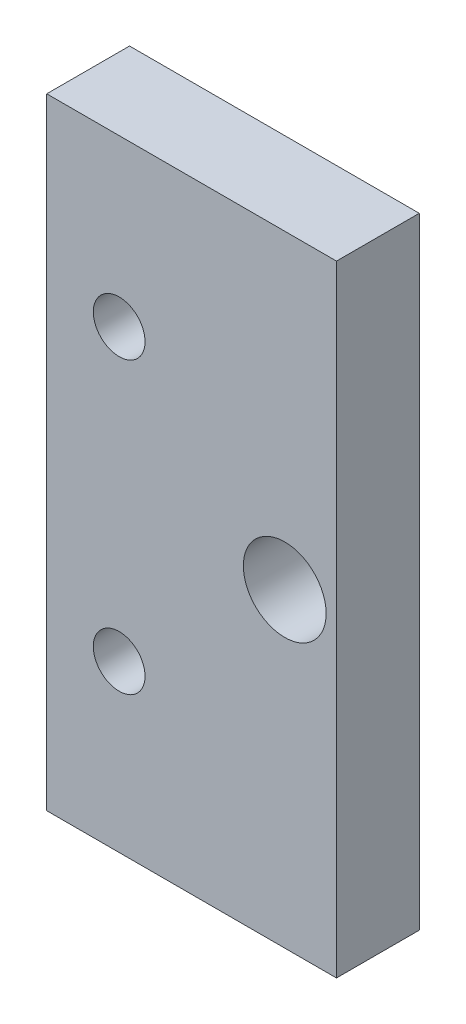
from build123d import *

# Parameters (mm, degrees)
SKETCH1_W      = 17.78
SKETCH1_H      = 38.1
SKETCH1_R      = 2.54
SKETCH1_R_2    = 1.5875
EXTRUDE1_DEPTH = 5.08


with BuildPart() as part:
    # Sketch1 → Extrude1 (new body)
    with BuildSketch(Plane.XY):
        Rectangle(SKETCH1_W, SKETCH1_H)
        with Locations((5.715, 0)):
            Circle(SKETCH1_R, mode=Mode.SUBTRACT)
        with Locations((-4.445, 8.89)):
            Circle(SKETCH1_R_2, mode=Mode.SUBTRACT)
        with Locations((-4.445, -8.89)):
            Circle(SKETCH1_R_2, mode=Mode.SUBTRACT)
    extrude(amount=EXTRUDE1_DEPTH)


solid = part.part
